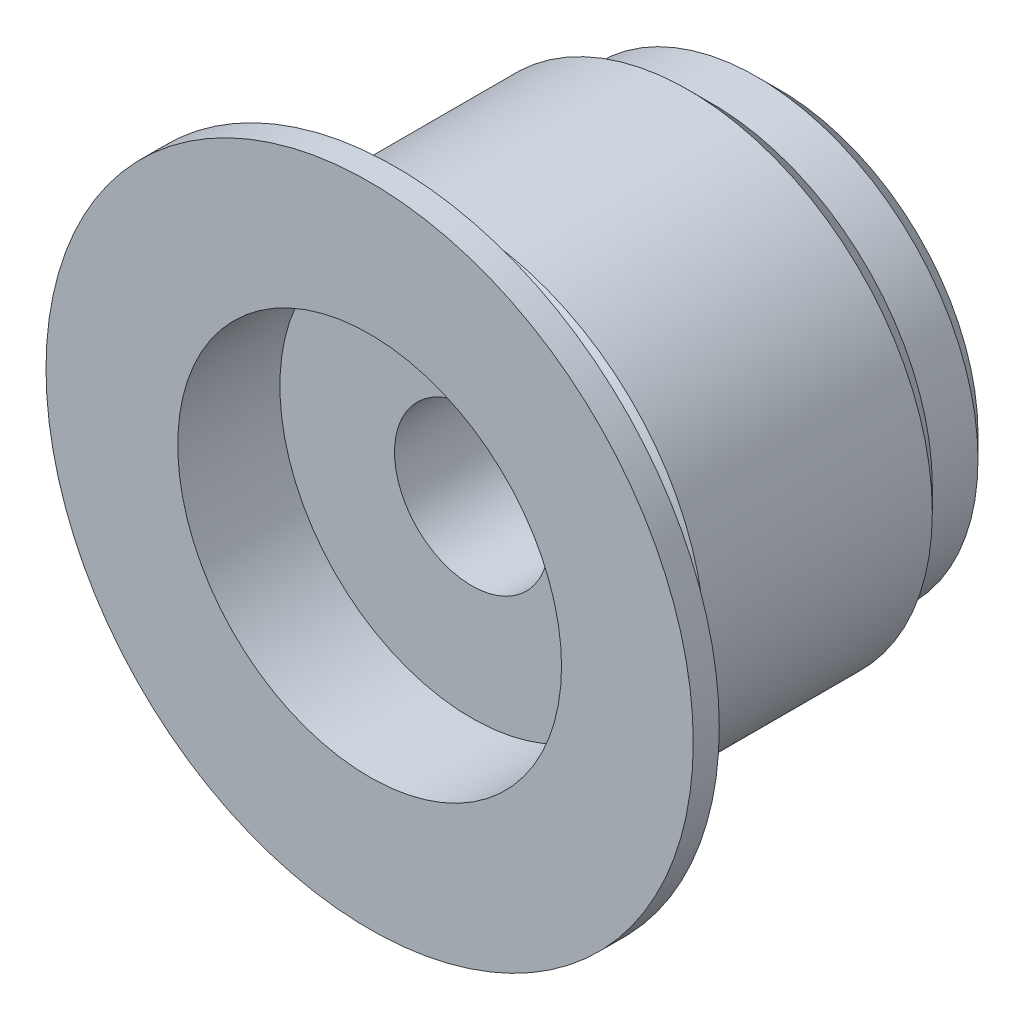
from build123d import *


with BuildPart() as part:
    # Sketch1 → Revolve1 (revolve)
    with BuildSketch(Plane(origin=(0, 0, 0), x_dir=(1, 0, 0), z_dir=(0, 1, 0)), mode=Mode.PRIVATE) as revolve1_sk:
        Polygon((-12.6365, 0), (-12.6365, 1.016), (-8.961769376, 2.992769376), (-9.525, 3.556), (-9.525, 12.446), (-8.626974388, 13.344025612), (-8.626974388, 15.127727136), (-7.752701524, 16.002), (0, 16.002), (0, 14.766345842), (-3.01625, 12.954), (-3.01625, 3.9878), (-7.493, 3.9878), (-7.493, 0), align=None)
    revolve(revolve1_sk.sketch.rotate(Axis((0, 0, 0), (0, 0, -1)), 180), axis=Axis((0, 0, 0), (0, 0, -1)))


solid = part.part
